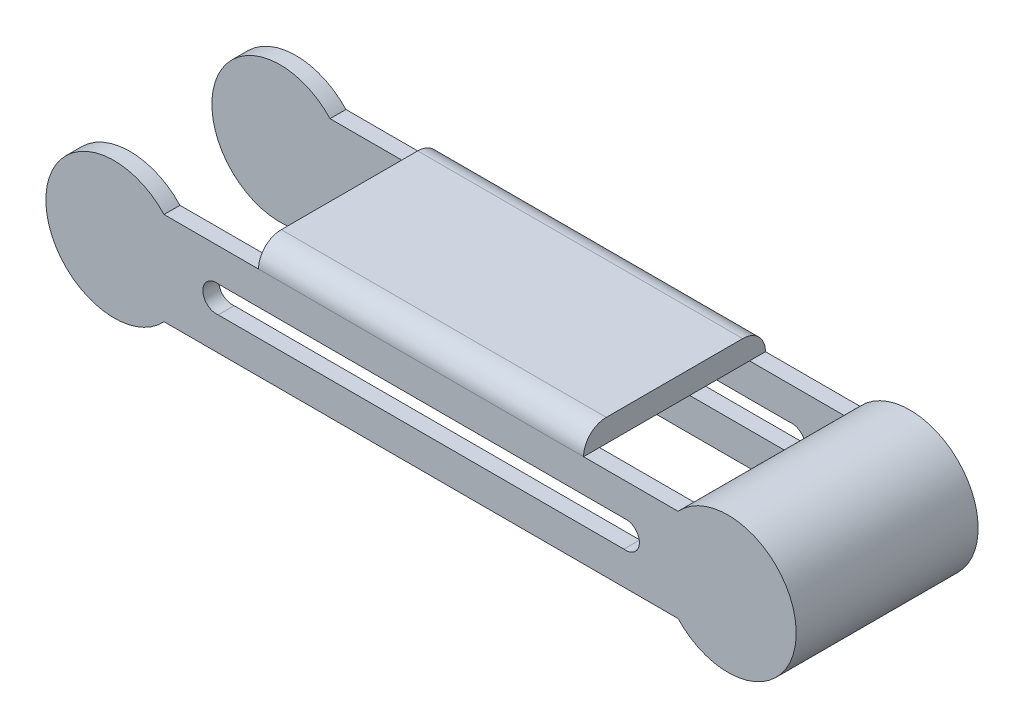
from build123d import *

# Parameters (mm, degrees)
BOSS_EXTRUDE1_DEPTH     = 40
CUT_EXTRUDE1_DEPTH      = 60
SKETCH3_W               = 113.025821482
SKETCH3_H               = 33
CUT_EXTRUDE2_DEPTH      = 25
CUT_EXTRUDE6_DEPTH      = 96.088865234
CUT_EXTRUDE6_DEPTH_BACK = 96.088865234
SKETCH7_W               = 50
SKETCH7_H               = 33
SKETCH8_W               = 71.47426929
SKETCH8_H               = 40
BOSS_EXTRUDE2_DEPTH     = 5
FILLET1_R               = 5
FILLET2_R               = 5


with BuildPart() as part:
    # Sketch1 → Boss-Extrude1 (new body)
    with BuildSketch(Plane.XY):
        with BuildLine():
            Line((-56.512910741, 10.211947396), (56.512910741, 10.211947396))
            ThreePointArc((56.512910741, 10.211947396), (82.5, 0), (56.512910741, -10.211947396))
            Line((56.512910741, -10.211947396), (-56.512910741, -10.211947396))
            ThreePointArc((-56.512910741, -10.211947396), (-82.5, 0), (-56.512910741, 10.211947396))
        make_face()
    extrude(amount=BOSS_EXTRUDE1_DEPTH)

    # Sketch2 → Cut-Extrude1 (cut)
    with BuildSketch(Plane.XY.offset(50)):
        with BuildLine():
            Line((44.606109659, 2.95), (-44.606109659, 2.95))
            ThreePointArc((-44.606109659, 2.95), (-47.976180371, 0), (-44.606109659, -2.95))
            Line((-44.606109659, -2.95), (44.606109659, -2.95))
            ThreePointArc((44.606109659, -2.95), (48.007891593, 0), (44.606109659, 2.95))
        make_face()
    extrude(amount=-CUT_EXTRUDE1_DEPTH, mode=Mode.SUBTRACT)

    # Sketch3 → Cut-Extrude2 (cut)
    with BuildSketch(Plane(origin=(0, 10.211947396, 0), x_dir=(1, 0, 0), z_dir=(0, 1, 0))):
        with Locations((0, -20)):
            Rectangle(SKETCH3_W, SKETCH3_H)
    extrude(amount=-CUT_EXTRUDE2_DEPTH, mode=Mode.SUBTRACT)

    # Sketch7 → Cut-Extrude6 (cut, two sides: drawn at the far end of the back side and taken through both)
    with BuildSketch(Plane(origin=(0, 10.211947396, 0), x_dir=(-1, 0, 0), z_dir=(0, -1, 0)).offset(-CUT_EXTRUDE6_DEPTH_BACK)):
        with Locations((81.512910741, -20)):
            Rectangle(SKETCH7_W, SKETCH7_H)
    extrude(amount=CUT_EXTRUDE6_DEPTH + CUT_EXTRUDE6_DEPTH_BACK, mode=Mode.SUBTRACT)

    # Sketch8 → Boss-Extrude2 (add)
    with BuildSketch(Plane(origin=(0, 10.211947396, 0), x_dir=(1, 0, 0), z_dir=(0, 1, 0))):
        with Locations((0, -20)):
            Rectangle(SKETCH8_W, SKETCH8_H)
    extrude(amount=BOSS_EXTRUDE2_DEPTH)

    # Fillet1
    fillet1_edges = [part.edges().sort_by_distance(p)[0] for p in [
        (0, 15.211947396, 40),
    ]]
    fillet(fillet1_edges, radius=FILLET1_R)

    # Fillet2
    fillet2_edges = [part.edges().sort_by_distance(p)[0] for p in [
        (0, 15.211947396, 0),
    ]]
    fillet(fillet2_edges, radius=FILLET2_R)


solid = part.part
